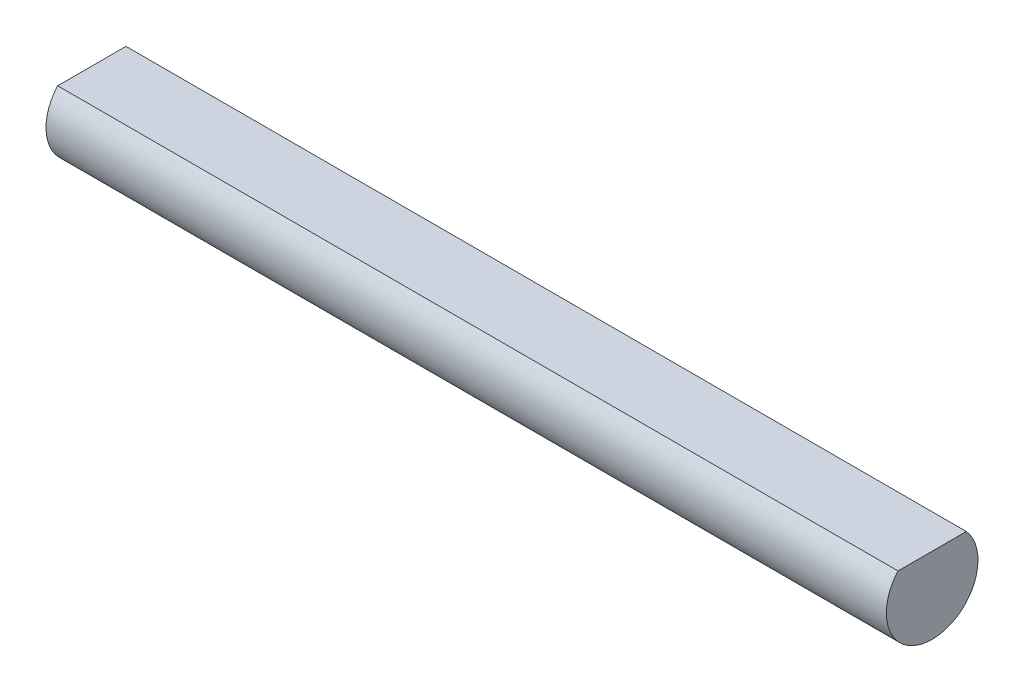
from build123d import *

# Parameters (mm, degrees)
BOSS_EXTRUDE1_DEPTH = 27.5


with BuildPart() as part:
    # Sketch1 → Boss-Extrude1 (new, symmetric)
    with BuildSketch(Plane(origin=(0, 0, 0), x_dir=(0, 0, -1), z_dir=(1, 0, 0))):
        with BuildLine():
            Line((-2.236067977, 2), (2.236067977, 2))
            ThreePointArc((2.236067977, 2), (0, -3), (-2.236067977, 2))
        make_face()
    extrude(amount=BOSS_EXTRUDE1_DEPTH, both=True)


solid = part.part
